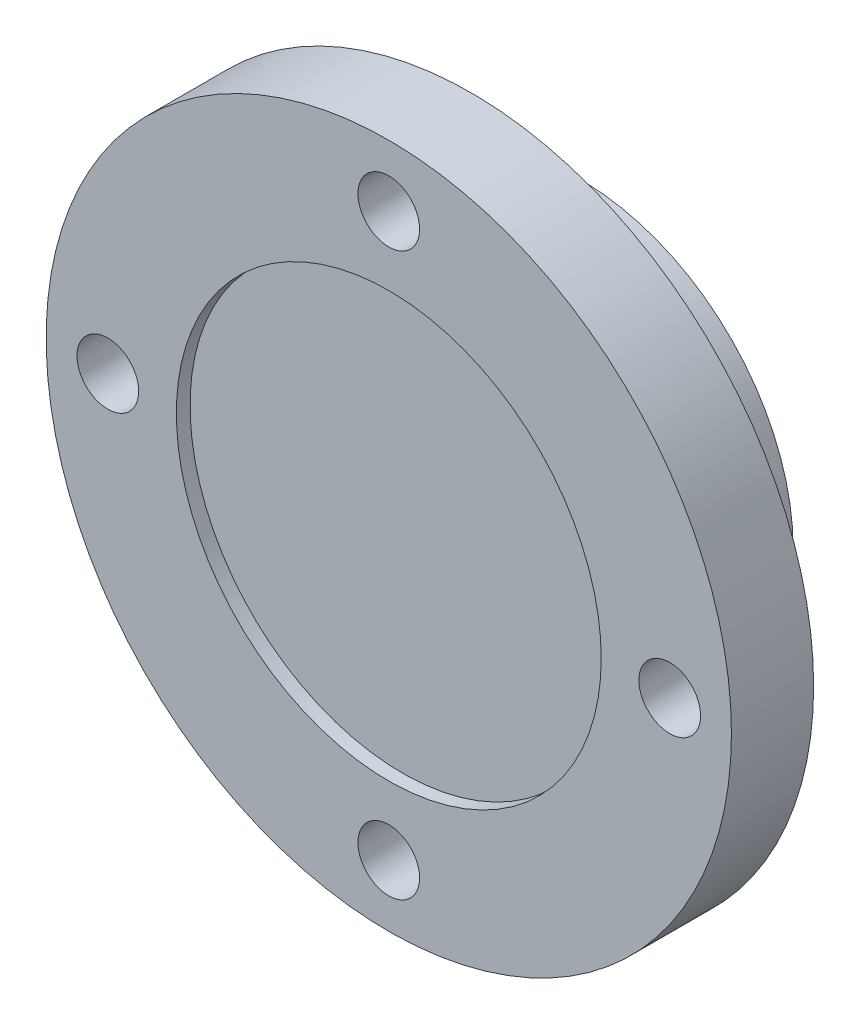
from build123d import *

# Parameters (mm, degrees)
SKETCH_2_R          = 4.5
CUT_EXTRUDE_1_DEPTH = 73.498275842


with BuildPart() as part:
    # 草图1 one side → 旋转4 (revolve)
    with BuildSketch(Plane(origin=(0, 0, 0), x_dir=(1, 0, 0), z_dir=(0, 1, 0)), mode=Mode.PRIVATE) as revolve_4_sk:
        with BuildLine():
            Line((0, 10), (-20.468871126, 10))
            ThreePointArc((-20.468871126, 10), (-23.116081379, 11.001287297), (-24.437982633, 13.503861062))
            Line((-24.437982633, 13.503861062), (-26, 26))
            Line((-26, 26), (-31, 26))
            Line((-31, 26), (-31, 10))
            Line((-31, 10), (-50, 10))
            Line((-50, 10), (-50, -2))
            Line((-50, -2), (-31, -2))
            Line((-31, -2), (-31, 0))
            Line((-31, 0), (0, 0))
            Line((0, 0), (0, 10))
        make_face()
    revolve(revolve_4_sk.sketch.rotate(Axis((0, 0, 0), (0, 0, -1)), 180), axis=Axis((0, 0, 0), (0, 0, -1)))

    # 草图2 → 切除-拉伸1 (cut, through all)
    with BuildSketch(Plane(origin=(0, 0, -10), x_dir=(-1, 0, 0), z_dir=(0, 0, -1))):
        with Locations((41, 0)):
            Circle(SKETCH_2_R)
        with Locations((0, -41)):
            Circle(SKETCH_2_R)
        with Locations((-41, 0)):
            Circle(SKETCH_2_R)
        with Locations((0, 41)):
            Circle(SKETCH_2_R)
    extrude(amount=-CUT_EXTRUDE_1_DEPTH, mode=Mode.SUBTRACT)


solid = part.part
